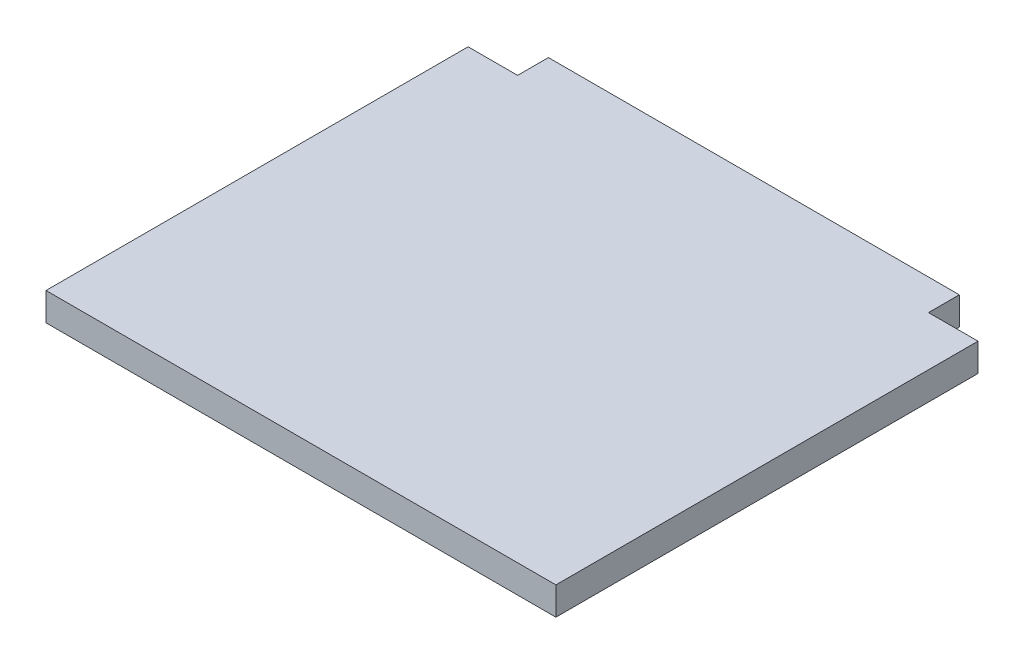
from build123d import *

# Parameters (mm, degrees)
BOSS_EXTRUDE1_DEPTH = 3


with BuildPart() as part:
    # Sketch2 → Boss-Extrude1 (new body)
    with BuildSketch(Plane(origin=(0, 0, 0), x_dir=(1, 0, 0), z_dir=(0, 1, 0))):
        Polygon((-27.3, 22.6), (-22, 22.6), (-22, 25.9), (22, 25.9), (22, 22.6), (27.3, 22.6), (27.3, -22.6), (-27.3, -22.6), align=None)
    extrude(amount=-BOSS_EXTRUDE1_DEPTH)


solid = part.part
